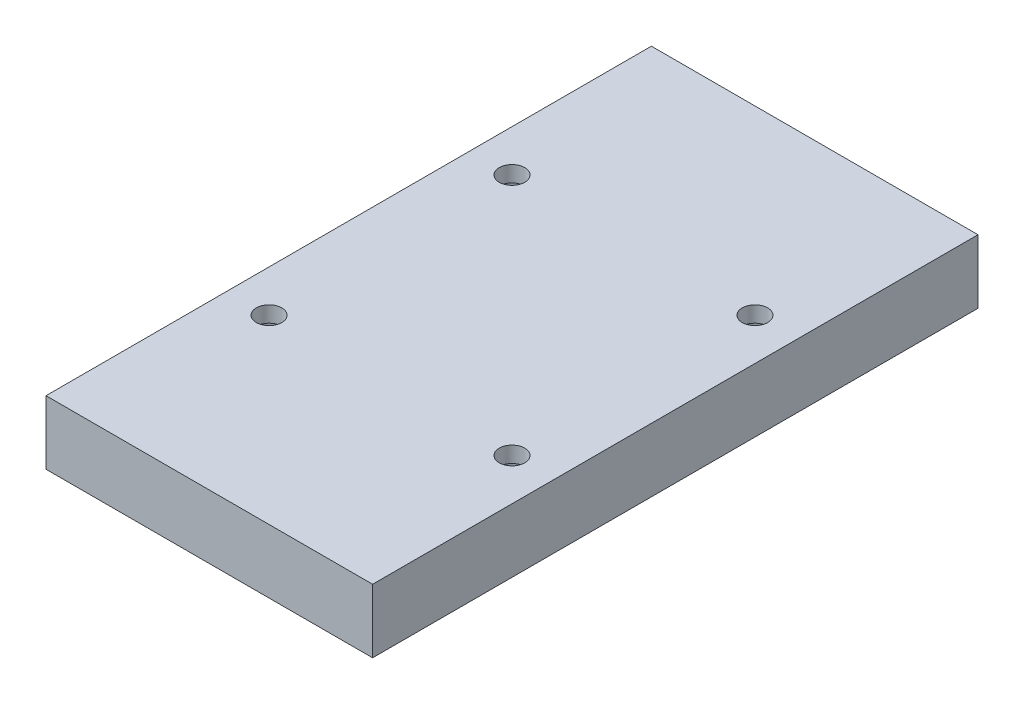
from build123d import *

# Parameters (mm, degrees)
SKETCH1_W                  = 35
SKETCH1_H                  = 70
BOSS_EXTRUDE1_DEPTH        = 5
EXTRUDE_THIN1_DEPTH        = 5
EXTRUDE_THIN1_DEPTH_BACK   = 3
SKETCH9_W                  = 41
SKETCH9_H                  = 76
SKETCH9_W_2                = 35
SKETCH9_H_2                = 70
F_3_2_3_2_DIAMETER_HOLE1_D = 3.2
CUT_EXTRUDE1_DEPTH         = 44.465503563
CUT_EXTRUDE1_DEPTH_BACK    = 3
SKETCH8_R                  = 3


with BuildPart() as part:
    # Sketch1 → Boss-Extrude1 (new body)
    with BuildSketch(Plane(origin=(0, 0, 0), x_dir=(1, 0, 0), z_dir=(0, 1, 0))):
        Rectangle(SKETCH1_W, SKETCH1_H)
    extrude(amount=-BOSS_EXTRUDE1_DEPTH)

    # Sketch9 → Extrude-Thin1 (add, two sides: drawn at the far end of the back side and taken through both)
    with BuildSketch(Plane(origin=(0, -5, 0), x_dir=(1, 0, 0), z_dir=(0, 1, 0)).offset(-EXTRUDE_THIN1_DEPTH_BACK)):
        Rectangle(SKETCH9_W, SKETCH9_H)
        Rectangle(SKETCH9_W_2, SKETCH9_H_2, mode=Mode.SUBTRACT)
    extrude(amount=EXTRUDE_THIN1_DEPTH + EXTRUDE_THIN1_DEPTH_BACK)

    # Ø3.2 (3.2) Diameter Hole1 (through all)
    with Locations(Plane(origin=(0, -5, 0), x_dir=(-1, 0, 0), z_dir=(0, -1, 0))):
        with Locations((15.25, 15.25), (15.25, -15.25), (-15.25, -15.25), (-15.25, 15.25)):
            Hole(F_3_2_3_2_DIAMETER_HOLE1_D / 2)

    # Sketch8 → Cut-Extrude1 (cut, two sides: drawn at the far end of the back side and taken through both)
    with BuildSketch(Plane.XZ.offset(5).offset(-CUT_EXTRUDE1_DEPTH_BACK)):
        with Locations(Location((-15.25, 15.25, 0), (0, 0, 138.590377891))):
            Circle(SKETCH8_R)
        with Locations(Location((15.25, 15.25, 0), (0, 0, 41.409622109))):
            Circle(SKETCH8_R)
        with Locations(Location((15.25, -15.25, 0), (0, 0, 41.409622109))):
            Circle(SKETCH8_R)
        with Locations(Location((-15.25, -15.25, 0), (0, 0, 138.590377891))):
            Circle(SKETCH8_R)
    extrude(amount=CUT_EXTRUDE1_DEPTH + CUT_EXTRUDE1_DEPTH_BACK, mode=Mode.SUBTRACT)


solid = part.part
